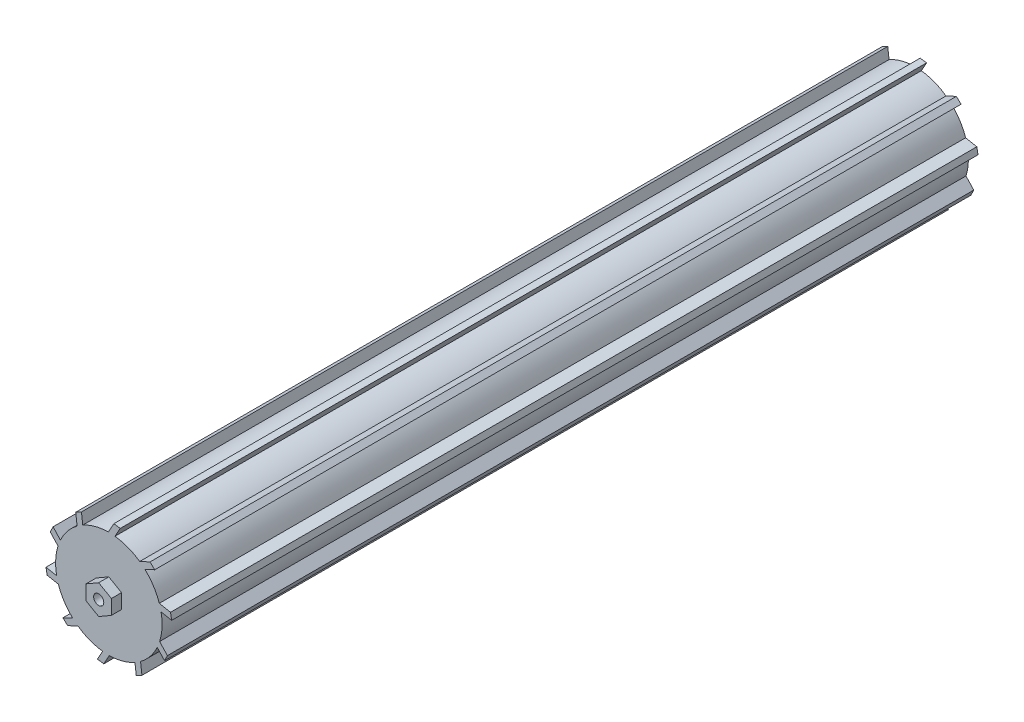
from build123d import *

# Parameters (mm, degrees)
SKETCH1_R           = 10.5
BOSS_EXTRUDE1_DEPTH = 76.5
SKETCH3_W           = 3
SKETCH3_H           = 3
BOSS_EXTRUDE2_DEPTH = 12
SKETCH4_R           = 1
BOSS_EXTRUDE3_DEPTH = 2
SKETCH7_R           = 10.5
SKETCH7_W           = 3
SKETCH7_H           = 3
BOSS_EXTRUDE4_DEPTH = 6
BOSS_EXTRUDE5_DEPTH = 159


with BuildPart() as part:
    # Sketch1 → Boss-Extrude1 (new, symmetric)
    with BuildSketch(Plane.XY):
        Circle(SKETCH1_R)
    extrude(amount=BOSS_EXTRUDE1_DEPTH, both=True)

    # Sketch3 → Boss-Extrude2 (add)
    with BuildSketch(Plane(origin=(0, 0, -76.5), x_dir=(-1, 0, 0), z_dir=(0, 0, -1))):
        Rectangle(SKETCH3_W, SKETCH3_H)
    extrude(amount=BOSS_EXTRUDE2_DEPTH)

    # Sketch4 → Boss-Extrude3 (add)
    with BuildSketch(Plane.XY.offset(76.5)):
        Polygon((0, 2.886751346), (-2.5, 1.443375673), (-2.5, -1.443375673), (0, -2.886751346), (2.5, -1.443375673), (2.5, 1.443375673), align=None)
        Circle(SKETCH4_R, mode=Mode.SUBTRACT)
    extrude(amount=BOSS_EXTRUDE3_DEPTH)

    # Sketch7 → Boss-Extrude4 (add)
    with BuildSketch(Plane(origin=(0, 0, -76.5), x_dir=(-1, 0, 0), z_dir=(0, 0, -1))):
        Circle(SKETCH7_R)
        Rectangle(SKETCH7_W, SKETCH7_H, mode=Mode.SUBTRACT)
    extrude(amount=BOSS_EXTRUDE4_DEPTH)

    # Sketch8 → Boss-Extrude5 (add)
    with BuildSketch(Plane.XY.offset(76.5)):
        Polygon((-0.228880958, 10.279411866), (0.985593436, 12.463206486), (2.253499249, 12.295191789), (1.036282986, 10.106466905), align=None)
        Polygon((9.050051597, 8.622445482), (6.778802746, 7.567191623), (5.856918112, 8.450751744), (8.123050808, 9.503628565), align=None)
        Polygon((12.389791835, 1.656218067), (9.93205026, 2.137506341), (9.705573533, 3.394191686), (12.157778863, 2.913987549), align=None)
        Polygon((10.997052705, -5.942628357), (9.291592153, -4.108633713), (9.847029745, -2.958834232), (11.548648621, -4.788697668), align=None)
        Polygon((5.403813218, -11.271592731), (5.102061653, -8.785415336), (6.227255282, -8.18168604), (6.52832713, -10.662263138), align=None)
        Polygon((-2.253499249, -12.295191789), (-1.036282986, -10.106466905), (0.228880958, -10.279411866), (-0.985593436, -12.463206486), align=None)
        Polygon((-9.050051597, -8.622445482), (-6.778802746, -7.567191623), (-5.856918112, -8.450751744), (-8.123050808, -9.503628565), align=None)
        Polygon((-12.389791835, -1.656218067), (-9.93205026, -2.137506341), (-9.705573533, -3.394191686), (-12.157778863, -2.913987549), align=None)
        Polygon((-10.997052705, 5.942628357), (-9.291592153, 4.108633713), (-9.847029745, 2.958834232), (-11.548648621, 4.788697668), align=None)
        Polygon((-5.403813218, 11.271592731), (-5.102061653, 8.785415336), (-6.227255282, 8.18168604), (-6.52832713, 10.662263138), align=None)
    extrude(amount=-BOSS_EXTRUDE5_DEPTH)


solid = part.part
